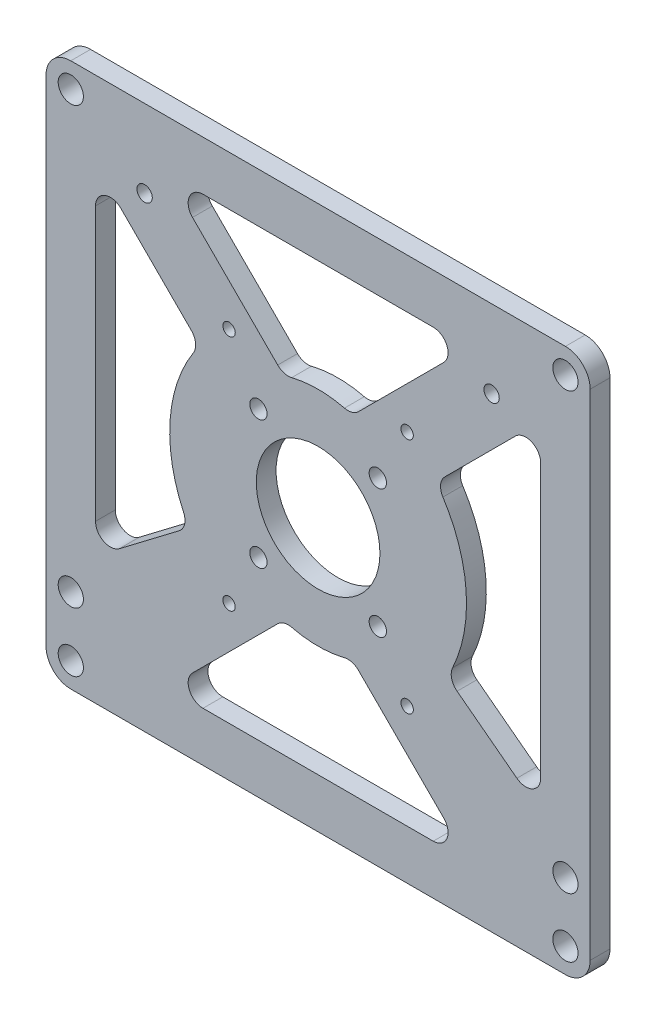
from build123d import *

# Parameters (mm, degrees)
SKETCH_2_R          = 1.55
SKETCH_2_R_2        = 1.25
SKETCH_2_R_3        = 1.75
SKETCH_2_R_4        = 2.55
EXTRUDE_1_DEPTH     = 4
FILLET_1_R          = 20
SKETCH_4_R          = 12.5
CUT_EXTRUDE_3_DEPTH = 4
EXTRUDE_START       = -4
EXTRUDE_2_DEPTH     = 4
FILLET_5_R          = 5
SKETCH_10_R         = 2.55
CUT_EXTRUDE_6_DEPTH = 10
EXTRUDE_3_DEPTH     = 4
FILLET_6_R          = 5
SKETCH_12_R         = 2.55
CUT_EXTRUDE_7_DEPTH = 4
CUT_EXTRUDE_8_DEPTH = 4
FILLET_7_R          = 3


with BuildPart() as part:
    # 草图2 → 凸台-拉伸1 (new body)
    with BuildSketch(Plane.XY.offset(50)):
        with BuildLine():
            Line((-25.35656347, 96.806195191), (-36.91814256, 90.799541468))
            ThreePointArc((-36.91814256, 90.799541468), (-37.739334229, 90.232640986), (-38.394655297, 89.480121078))
            Line((-38.394655297, 89.480121078), (-45.6586136, 78.66416482))
            ThreePointArc((-45.6586136, 78.66416482), (-52.612848944, 64.027729908), (-55, 48))
            Line((-55, 48), (-55, 10))
            ThreePointArc((-55, 10), (-53.535533906, 6.464466094), (-50, 5))
            Line((-50, 5), (-34.292856399, 5))
            ThreePointArc((-34.292856399, 5), (0, -7), (34.292856399, 5))
            Line((34.292856399, 5), (50, 5))
            ThreePointArc((50, 5), (53.535533906, 6.464466094), (55, 10))
            Line((55, 10), (55, 48))
            ThreePointArc((55, 48), (52.612848944, 64.027729908), (45.6586136, 78.66416482))
            Line((45.6586136, 78.66416482), (38.394655297, 89.480121078))
            ThreePointArc((38.394655297, 89.480121078), (37.739334229, 90.232640986), (36.91814256, 90.799541468))
            Line((36.91814256, 90.799541468), (25.35656347, 96.806195191))
            ThreePointArc((25.35656347, 96.806195191), (0, 103), (-25.35656347, 96.806195191))
        make_face()
        with Locations((-35.074028853, 87.25)):
            Circle(SKETCH_2_R, mode=Mode.SUBTRACT)
        with Locations((-18, 72)):
            Circle(SKETCH_2_R_2, mode=Mode.SUBTRACT)
        with Locations((-12.07, 61)):
            Circle(SKETCH_2_R_3, mode=Mode.SUBTRACT)
        with Locations((-12.07, 35)):
            Circle(SKETCH_2_R_3, mode=Mode.SUBTRACT)
        with Locations((-18, 24)):
            Circle(SKETCH_2_R_2, mode=Mode.SUBTRACT)
        with Locations((18, 72)):
            Circle(SKETCH_2_R_2, mode=Mode.SUBTRACT)
        with Locations((12.07, 61)):
            Circle(SKETCH_2_R_3, mode=Mode.SUBTRACT)
        with Locations((12.07, 35)):
            Circle(SKETCH_2_R_3, mode=Mode.SUBTRACT)
        with Locations((35.074028853, 87.25)):
            Circle(SKETCH_2_R, mode=Mode.SUBTRACT)
        with Locations((18, 24)):
            Circle(SKETCH_2_R_2, mode=Mode.SUBTRACT)
        with Locations((-50, 10)):
            Circle(SKETCH_2_R_4, mode=Mode.SUBTRACT)
        with Locations((50, 10)):
            Circle(SKETCH_2_R_4, mode=Mode.SUBTRACT)
    extrude(amount=EXTRUDE_1_DEPTH)

    # 圆角1
    fillet_1_edges = [part.edges().sort_by_distance(p)[0] for p in [
        (-34.292856399, 5, 52),
        (34.292856399, 5, 52),
    ]]
    fillet(fillet_1_edges, radius=FILLET_1_R)

    # 草图4 → 切除-拉伸3 (cut)
    with BuildSketch(Plane.XY.offset(54)):
        with Locations((0, 48)):
            Circle(SKETCH_4_R)
    extrude(amount=-CUT_EXTRUDE_3_DEPTH, mode=Mode.SUBTRACT)

    # 草图8 → 凸台-拉伸2 (add)
    with BuildSketch(Plane.XY.offset(54).offset(EXTRUDE_START)):
        with BuildLine():
            Line((-55, 103), (-55, 48))
            ThreePointArc((-55, 48), (-52.612848944, 64.027729908), (-45.6586136, 78.66416482))
            Line((-45.6586136, 78.66416482), (-38.394655297, 89.480121078))
            ThreePointArc((-38.394655297, 89.480121078), (-37.739334229, 90.232640986), (-36.91814256, 90.799541468))
            Line((-36.91814256, 90.799541468), (-25.35656347, 96.806195191))
            ThreePointArc((-25.35656347, 96.806195191), (-13.051039509, 101.429115356), (0, 103))
            Line((0, 103), (-55, 103))
        make_face()
    extrude_2 = extrude(amount=EXTRUDE_2_DEPTH)

    # 镜向4: 凸台-拉伸2 across plane
    add(extrude_2.mirror(Plane(origin=(0, 0, 0), x_dir=(0, 0, 1), z_dir=(1, 0, 0))))

    # 圆角5
    fillet_5_edges = [part.edges().sort_by_distance(p)[0] for p in [
        (-55, 103, 52),
        (55, 103, 52),
    ]]
    fillet(fillet_5_edges, radius=FILLET_5_R)

    # 草图10 → 切除-拉伸6 (cut)
    with BuildSketch(Plane.XY.offset(54)):
        with Locations((-50, 98)):
            Circle(SKETCH_10_R)
        with Locations((50, 98)):
            Circle(SKETCH_10_R)
    extrude(amount=-CUT_EXTRUDE_6_DEPTH, mode=Mode.SUBTRACT)

    # 草图11 → 凸台-拉伸3 (add)
    with BuildSketch(Plane(origin=(0, 0, 50), x_dir=(-1, 0, 0), z_dir=(0, 0, -1))):
        with BuildLine():
            ThreePointArc((-50, 5), (-53.535533906, 6.464466094), (-55, 10))
            Line((-55, 10), (-55, -7))
            Line((-55, -7), (0, -7))
            ThreePointArc((0, -7), (-15.556349186, -4.754146756), (-29.842251926, 1.8))
            ThreePointArc((-29.842251926, 1.8), (-35.037125649, 4.183326093), (-40.693979899, 5))
            Line((-40.693979899, 5), (-50, 5))
        make_face()
        with BuildLine():
            ThreePointArc((29.842251926, 1.8), (15.556349186, -4.754146756), (0, -7))
            Line((0, -7), (55, -7))
            Line((55, -7), (55, 10))
            ThreePointArc((55, 10), (53.535533906, 6.464466094), (50, 5))
            Line((50, 5), (40.693979899, 5))
            ThreePointArc((40.693979899, 5), (35.037125649, 4.183326093), (29.842251926, 1.8))
        make_face()
    extrude(amount=-EXTRUDE_3_DEPTH)

    # 圆角6
    fillet_6_edges = [part.edges().sort_by_distance(p)[0] for p in [
        (55, -7, 52),
        (-55, -7, 52),
    ]]
    fillet(fillet_6_edges, radius=FILLET_6_R)

    # 草图12 → 切除-拉伸7 (cut)
    with BuildSketch(Plane(origin=(0, 0, 50), x_dir=(-1, 0, 0), z_dir=(0, 0, -1))):
        with Locations((-50, -2)):
            Circle(SKETCH_12_R)
        with Locations((50, -2)):
            Circle(SKETCH_12_R)
    extrude(amount=-CUT_EXTRUDE_7_DEPTH, mode=Mode.SUBTRACT)

    # 草图13 → 切除-拉伸8 (cut)
    with BuildSketch(Plane.XY.offset(54)):
        with BuildLine():
            Line((-23.852223166, 66.195368917), (-45, 87.343145751))
            Line((-45, 87.343145751), (-45, 18.82410191))
            Line((-45, 18.82410191), (-26.091936894, 33.19422987))
            ThreePointArc((-26.091936894, 33.19422987), (-29.931147249, 50.031360229), (-23.852223166, 66.195368917))
        make_face()
        with BuildLine():
            Line((0, 70.5), (0, 93))
            Line((0, 93), (-30.514718626, 93))
            Line((-30.514718626, 93), (-6.923133414, 69.408414788))
            ThreePointArc((-6.923133414, 69.408414788), (-3.504330697, 70.225428373), (0, 70.5))
        make_face()
        with BuildLine():
            Line((0, 3), (0, 25.5))
            ThreePointArc((0, 25.5), (-3.504330697, 25.774571627), (-6.923133414, 26.591585212))
            Line((-6.923133414, 26.591585212), (-30.514718626, 3))
            Line((-30.514718626, 3), (0, 3))
        make_face()
    cut_extrude_8 = extrude(amount=-CUT_EXTRUDE_8_DEPTH, mode=Mode.SUBTRACT)

    # 镜向5: 切除-拉伸8 across plane
    add(cut_extrude_8.mirror(Plane(origin=(0, 0, 0), x_dir=(0, 0, 1), z_dir=(1, 0, 0))), mode=Mode.SUBTRACT)

    # 圆角7
    fillet_7_edges = [part.edges().sort_by_distance(p)[0] for p in [
        (-30.514718626, 3, 52),
        (-6.923133414, 26.591585212, 52),
        (-6.923133414, 69.408414788, 52),
        (-30.514718626, 93, 52),
        (-23.852223166, 66.195368917, 52),
        (-26.091936894, 33.19422987, 52),
        (-45, 18.82410191, 52),
        (-45, 87.343145751, 52),
        (6.923133414, 26.591585212, 52),
        (30.514718626, 3, 52),
        (30.514718626, 93, 52),
        (6.923133414, 69.408414788, 52),
        (26.091936894, 33.19422987, 52),
        (23.852223166, 66.195368917, 52),
        (45, 87.343145751, 52),
        (45, 18.82410191, 52),
    ]]
    fillet(fillet_7_edges, radius=FILLET_7_R)


solid = part.part
